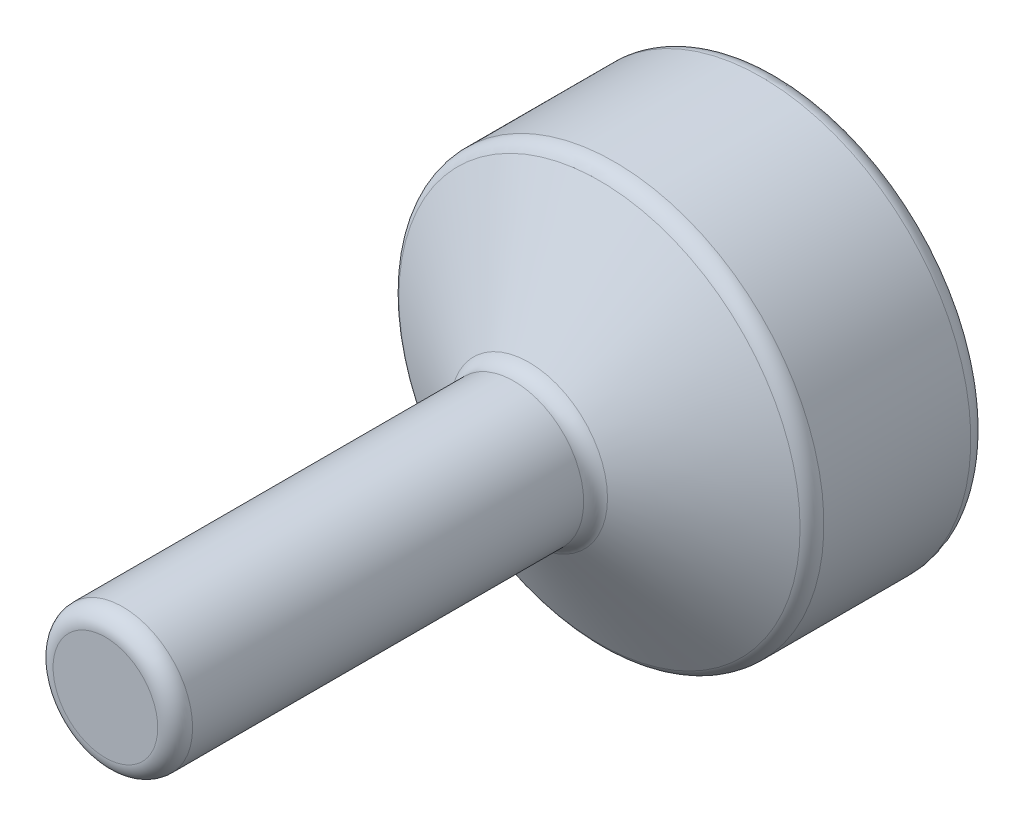
from build123d import *

# Parameters (mm, degrees)
FILLET1_R = 0.254


with BuildPart() as part:
    # Sketch1 → Revolve1 (revolve)
    with BuildSketch(Plane(origin=(0, 0, 0), x_dir=(1, 0, 0), z_dir=(0, 1, 0))):
        Polygon((0, 0), (3.048, 0), (3.048, -2.54), (1.016, -3.713175747), (1.016, -9.809175747), (0, -9.809175747), align=None)
    revolve(axis=Axis((0, 0, 9.809175747), (0, 0, -1)))

    # Fillet1
    fillet1_edges = [part.edges().sort_by_distance(p)[0] for p in [
        (-1.016, 0, 9.809175747),
        (-1.016, 0, 3.713175747),
        (-3.048, 0, 2.54),
        (-3.048, 0, 0),
    ]]
    fillet(fillet1_edges, radius=FILLET1_R)


solid = part.part
